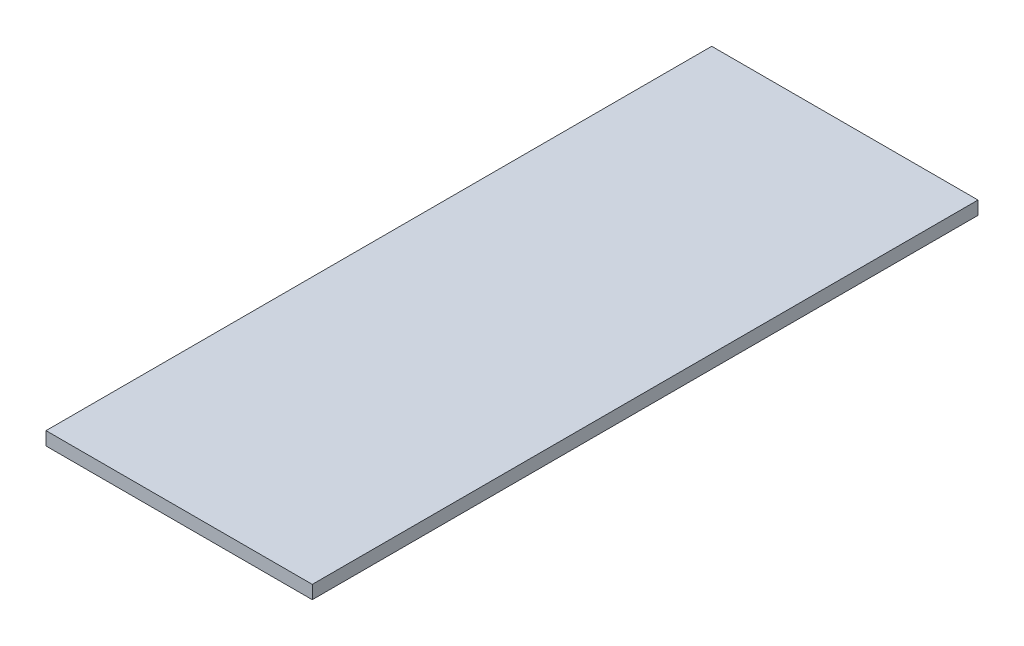
from build123d import *

# Parameters (mm, degrees)
SCHIZZO1_W                   = 400
SCHIZZO1_H                   = 1000
ESTRUSIONE_ESTRUSIONE1_DEPTH = 20
SCHIZZO2_R                   = 20
ESTRUSIONE_ESTRUSIONE2_DEPTH = 50
ESTRUSIONE_ESTRUSIONE2_TAPER = 12


with BuildPart() as part:
    # Schizzo1 → Estrusione-Estrusione1 (new body)
    with BuildSketch(Plane(origin=(0, 0, 0), x_dir=(1, 0, 0), z_dir=(0, 1, 0))):
        with Locations((200, 500)):
            Rectangle(SCHIZZO1_W, SCHIZZO1_H)
    extrude(amount=ESTRUSIONE_ESTRUSIONE1_DEPTH)

    # Schizzo2 → Estrusione-Estrusione2 (add)
    with BuildSketch(Plane(origin=(0, 0, 0), x_dir=(-1, 0, 0), z_dir=(0, -1, 0))):
        with Locations((-200, 500)):
            Circle(SCHIZZO2_R)
    extrude(amount=ESTRUSIONE_ESTRUSIONE2_DEPTH, taper=ESTRUSIONE_ESTRUSIONE2_TAPER)

    # Schizzo4 → Rivoluzione1 (revolve)
    with BuildSketch(Plane(origin=(200, 0, 0), x_dir=(0, 0, -1), z_dir=(1, 0, 0))):
        with BuildLine():
            Line((485, -60), (515, -60))
            ThreePointArc((515, -60), (500, -45), (485, -60))
        make_face()
    revolve(axis=Axis((200, -60, -485), (0, 0, -1)))


solid = part.part
